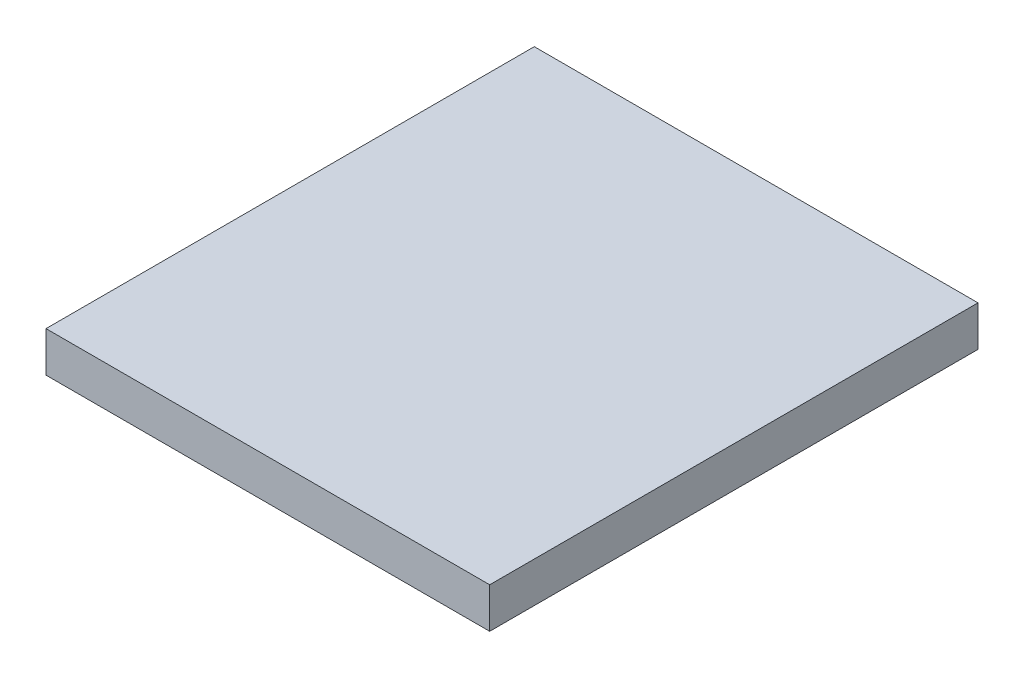
from build123d import *

# Parameters (mm, degrees)
SKETCH1_W           = 108.99472697
SKETCH1_H           = 119.95472409
BOSS_EXTRUDE1_DEPTH = 9.906


with BuildPart() as part:
    # Sketch1 → Boss-Extrude1 (new body)
    with BuildSketch(Plane(origin=(0, 0, 0), x_dir=(1, 0, 0), z_dir=(0, 1, 0))):
        Rectangle(SKETCH1_W, SKETCH1_H)
    extrude(amount=BOSS_EXTRUDE1_DEPTH)


solid = part.part
